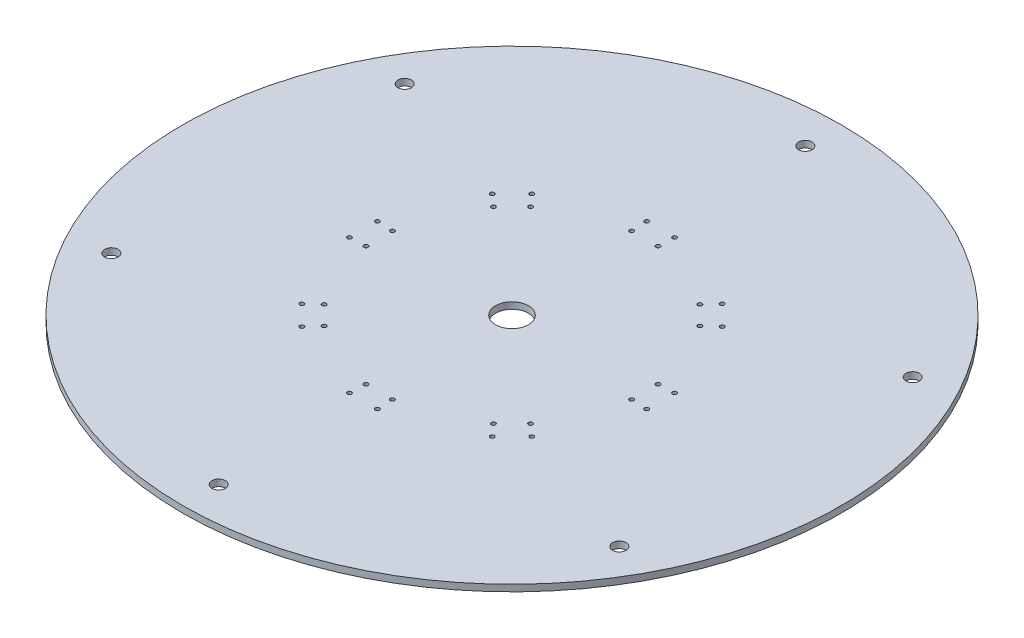
from build123d import *

# Parameters (mm, degrees)
SKETCH1_R           = 250
SKETCH1_R_2         = 5.1
SKETCH1_R_3         = 12.5
SKETCH1_R_4         = 1.6
BOSS_EXTRUDE1_DEPTH = 2.5


with BuildPart() as part:
    # Sketch1 → Boss-Extrude1 (new, symmetric)
    with BuildSketch(Plane(origin=(0, 0, 0), x_dir=(1, 0, 0), z_dir=(0, 1, 0))):
        with Locations(Location((0, 0, 0), (0, 0, 270))):
            Circle(SKETCH1_R)
        with Locations(Location((0, 222.5, 0), (0, 0, 270))):
            Circle(SKETCH1_R_2, mode=Mode.SUBTRACT)
        with Locations(Location((192.690652342, 111.25, 0), (0, 0, 270))):
            Circle(SKETCH1_R_2, mode=Mode.SUBTRACT)
        with Locations(Location((192.690652342, -111.25, 0), (0, 0, 270))):
            Circle(SKETCH1_R_2, mode=Mode.SUBTRACT)
        with Locations(Location((0, -222.5, 0), (0, 0, 270))):
            Circle(SKETCH1_R_2, mode=Mode.SUBTRACT)
        with Locations(Location((-192.690652342, -111.25, 0), (0, 0, 270))):
            Circle(SKETCH1_R_2, mode=Mode.SUBTRACT)
        with Locations(Location((-192.690652342, 111.25, 0), (0, 0, 270))):
            Circle(SKETCH1_R_2, mode=Mode.SUBTRACT)
        with Locations(Location((0, 0, 0), (0, 0, 270))):
            Circle(SKETCH1_R_3, mode=Mode.SUBTRACT)
        with Locations(Location((-10, 100.754962657, 0), (0, 0, 270))):
            Circle(SKETCH1_R_4, mode=Mode.SUBTRACT)
        with Locations(Location((10, 100.754962657, 0), (0, 0, 270))):
            Circle(SKETCH1_R_4, mode=Mode.SUBTRACT)
        with Locations(Location((-10.575, 112.738110965, 0), (0, 0, 270))):
            Circle(SKETCH1_R_4, mode=Mode.SUBTRACT)
        with Locations(Location((10.575, 112.738110965, 0), (0, 0, 90))):
            Circle(SKETCH1_R_4, mode=Mode.SUBTRACT)
        with Locations(Location((72.240228551, 87.195536973, 0), (0, 0, 270))):
            Circle(SKETCH1_R_4, mode=Mode.SUBTRACT)
        with Locations(Location((87.195536973, 72.240228551, 0), (0, 0, 90))):
            Circle(SKETCH1_R_4, mode=Mode.SUBTRACT)
        with Locations(Location((78.315585145, 64.173449521, 0), (0, 0, 270))):
            Circle(SKETCH1_R_4, mode=Mode.SUBTRACT)
        with Locations(Location((64.173449521, 78.315585145, 0), (0, 0, 270))):
            Circle(SKETCH1_R_4, mode=Mode.SUBTRACT)
        with Locations(Location((112.738110965, 10.575, 0), (0, 0, 270))):
            Circle(SKETCH1_R_4, mode=Mode.SUBTRACT)
        with Locations(Location((112.738110965, -10.575, 0), (0, 0, 90))):
            Circle(SKETCH1_R_4, mode=Mode.SUBTRACT)
        with Locations(Location((100.754962657, -10, 0), (0, 0, 270))):
            Circle(SKETCH1_R_4, mode=Mode.SUBTRACT)
        with Locations(Location((100.754962657, 10, 0), (0, 0, 270))):
            Circle(SKETCH1_R_4, mode=Mode.SUBTRACT)
        with Locations(Location((87.195536973, -72.240228551, 0), (0, 0, 270))):
            Circle(SKETCH1_R_4, mode=Mode.SUBTRACT)
        with Locations(Location((72.240228551, -87.195536973, 0), (0, 0, 90))):
            Circle(SKETCH1_R_4, mode=Mode.SUBTRACT)
        with Locations(Location((64.173449521, -78.315585145, 0), (0, 0, 270))):
            Circle(SKETCH1_R_4, mode=Mode.SUBTRACT)
        with Locations(Location((78.315585145, -64.173449521, 0), (0, 0, 270))):
            Circle(SKETCH1_R_4, mode=Mode.SUBTRACT)
        with Locations(Location((10.575, -112.738110965, 0), (0, 0, 270))):
            Circle(SKETCH1_R_4, mode=Mode.SUBTRACT)
        with Locations(Location((-10.575, -112.738110965, 0), (0, 0, 90))):
            Circle(SKETCH1_R_4, mode=Mode.SUBTRACT)
        with Locations(Location((-10, -100.754962657, 0), (0, 0, 270))):
            Circle(SKETCH1_R_4, mode=Mode.SUBTRACT)
        with Locations(Location((10, -100.754962657, 0), (0, 0, 270))):
            Circle(SKETCH1_R_4, mode=Mode.SUBTRACT)
        with Locations(Location((-72.240228551, -87.195536973, 0), (0, 0, 270))):
            Circle(SKETCH1_R_4, mode=Mode.SUBTRACT)
        with Locations(Location((-87.195536973, -72.240228551, 0), (0, 0, 90))):
            Circle(SKETCH1_R_4, mode=Mode.SUBTRACT)
        with Locations(Location((-78.315585145, -64.173449521, 0), (0, 0, 270))):
            Circle(SKETCH1_R_4, mode=Mode.SUBTRACT)
        with Locations(Location((-64.173449521, -78.315585145, 0), (0, 0, 270))):
            Circle(SKETCH1_R_4, mode=Mode.SUBTRACT)
        with Locations(Location((-112.738110965, -10.575, 0), (0, 0, 270))):
            Circle(SKETCH1_R_4, mode=Mode.SUBTRACT)
        with Locations(Location((-112.738110965, 10.575, 0), (0, 0, 90))):
            Circle(SKETCH1_R_4, mode=Mode.SUBTRACT)
        with Locations(Location((-100.754962657, 10, 0), (0, 0, 270))):
            Circle(SKETCH1_R_4, mode=Mode.SUBTRACT)
        with Locations(Location((-100.754962657, -10, 0), (0, 0, 270))):
            Circle(SKETCH1_R_4, mode=Mode.SUBTRACT)
        with Locations(Location((-87.195536973, 72.240228551, 0), (0, 0, 270))):
            Circle(SKETCH1_R_4, mode=Mode.SUBTRACT)
        with Locations(Location((-72.240228551, 87.195536973, 0), (0, 0, 90))):
            Circle(SKETCH1_R_4, mode=Mode.SUBTRACT)
        with Locations(Location((-64.173449521, 78.315585145, 0), (0, 0, 270))):
            Circle(SKETCH1_R_4, mode=Mode.SUBTRACT)
        with Locations(Location((-78.315585145, 64.173449521, 0), (0, 0, 270))):
            Circle(SKETCH1_R_4, mode=Mode.SUBTRACT)
    extrude(amount=BOSS_EXTRUDE1_DEPTH, both=True)


solid = part.part
